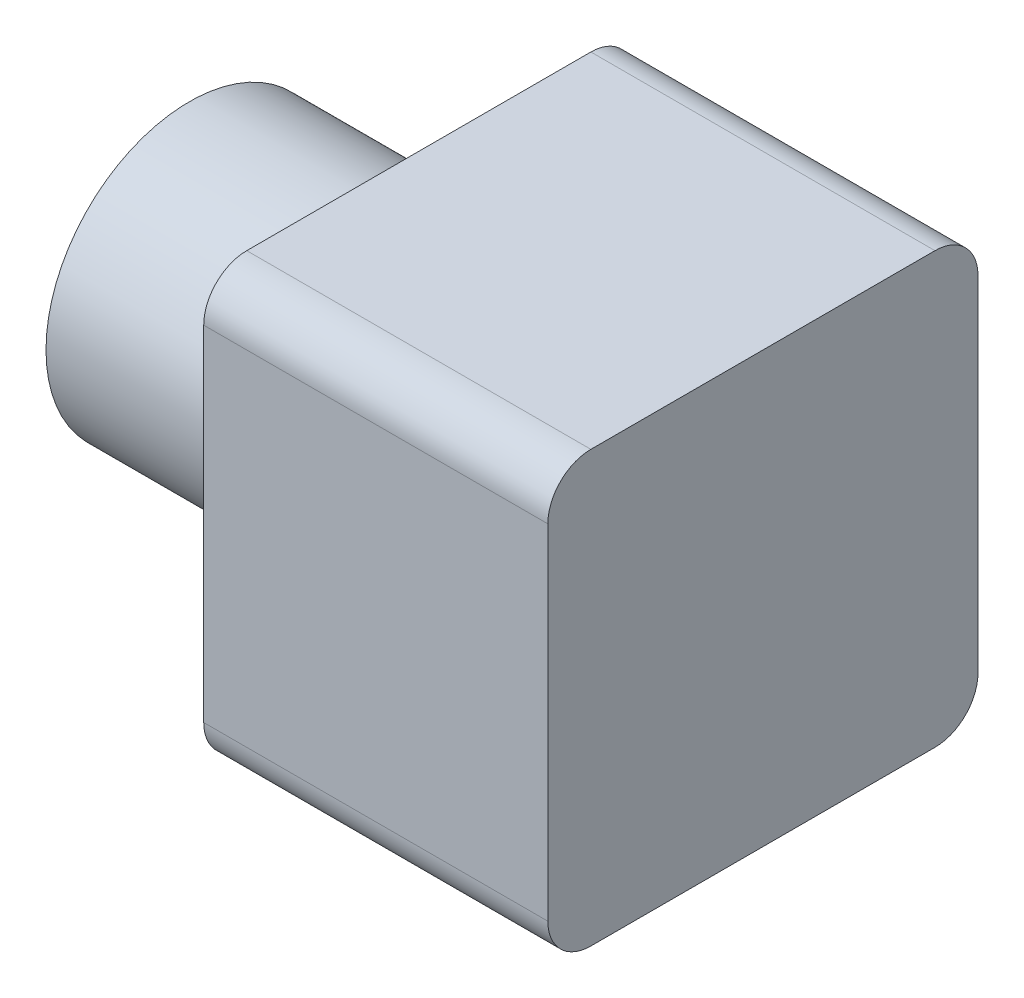
from build123d import *

# Parameters (mm, degrees)
SKETCH2_R           = 5
BOSS_EXTRUDE1_DEPTH = 8
SKETCH3_W           = 15
SKETCH3_H           = 15
BOSS_EXTRUDE2_DEPTH = 12
SKETCH4_R           = 4
CUT_EXTRUDE1_DEPTH  = 1
FILLET1_R           = 1.5


with BuildPart() as part:
    # Sketch2 → Boss-Extrude1 (new body)
    with BuildSketch(Plane.ZY.offset(36.137829577)):
        with Locations((-25, -31.600577771)):
            Circle(SKETCH2_R)
    extrude(amount=BOSS_EXTRUDE1_DEPTH)

    # Sketch3 → Boss-Extrude2 (add)
    with BuildSketch(Plane(origin=(-36.137829577, 0, 0), x_dir=(0, 0, -1), z_dir=(1, 0, 0))):
        with Locations((25, -31.600577771)):
            Rectangle(SKETCH3_W, SKETCH3_H)
    extrude(amount=BOSS_EXTRUDE2_DEPTH)

    # Sketch4 → Cut-Extrude1 (cut)
    with BuildSketch(Plane.ZY.offset(44.137829577)):
        with Locations((-25, -31.600577771)):
            Circle(SKETCH4_R)
    extrude(amount=-CUT_EXTRUDE1_DEPTH, mode=Mode.SUBTRACT)

    # Fillet1
    fillet1_edges = [part.edges().sort_by_distance(p)[0] for p in [
        (-30.137829577, -24.100577771, -17.5),
        (-30.137829577, -39.100577771, -17.5),
        (-30.137829577, -39.100577771, -32.5),
        (-30.137829577, -24.100577771, -32.5),
    ]]
    fillet(fillet1_edges, radius=FILLET1_R)


solid = part.part
